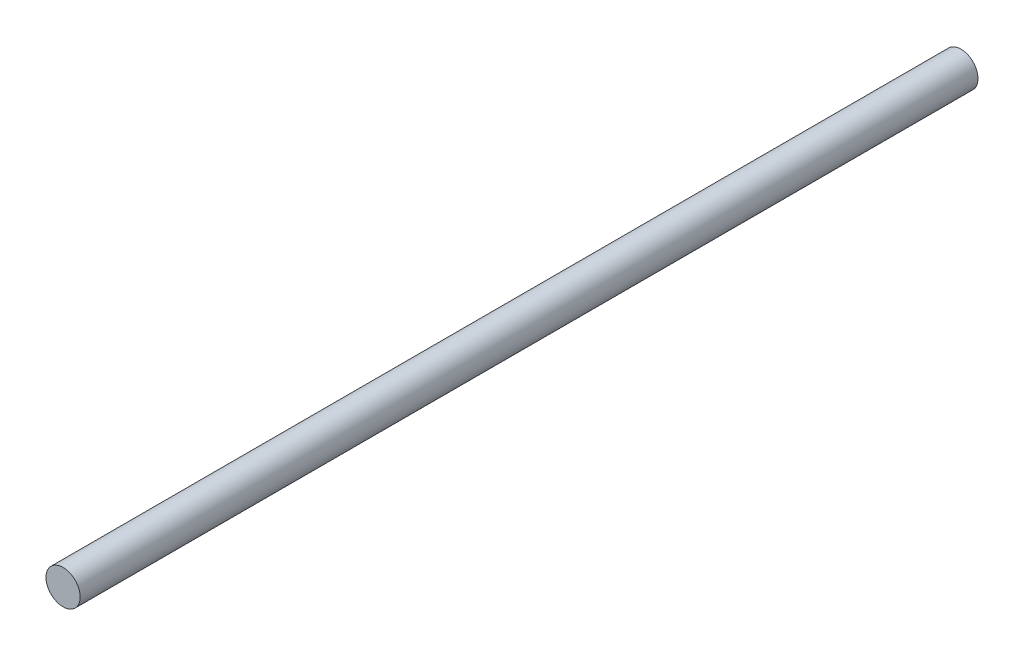
from build123d import *

# Parameters (mm, degrees)
SKETCH1_R  = 4
BODY_DEPTH = 210


with BuildPart() as part:
    # Sketch1 → body (new body)
    with BuildSketch(Plane.XY):
        Circle(SKETCH1_R)
    extrude(amount=BODY_DEPTH)


solid = part.part
